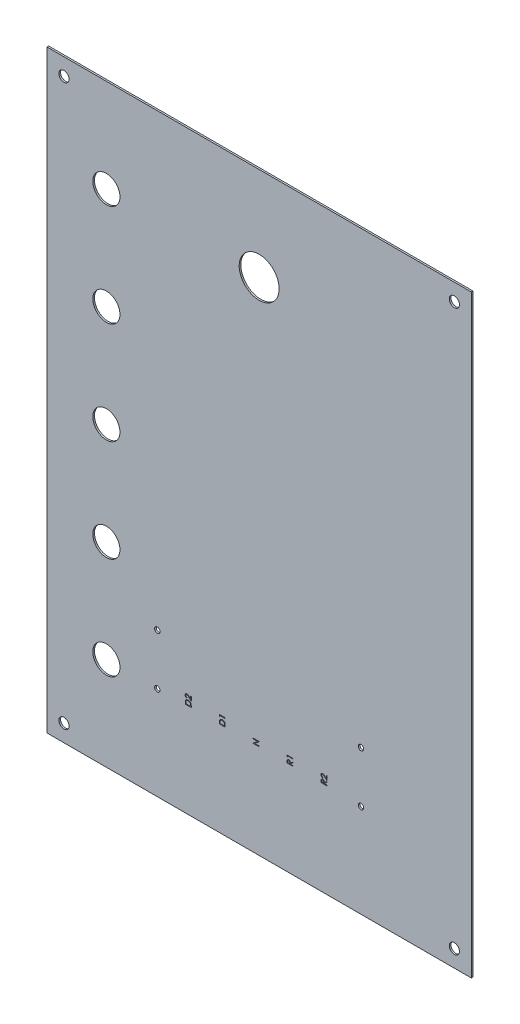
from build123d import *

# Parameters (mm, degrees)
SKETCH1_W           = 350
SKETCH1_H           = 250
BOSS_EXTRUDE1_DEPTH = 1
SKETCH3_R           = 8
SKETCH3_R_2         = 11.75
SKETCH3_R_3         = 3
CUT_EXTRUDE2_DEPTH  = 216.060456616
SKETCH4_R           = 1.6
CUT_EXTRUDE5_DEPTH  = 216.060456616


with BuildPart() as part:
    # Sketch1 → Boss-Extrude1 (new body)
    with BuildSketch(Plane(origin=(0, 0, 0), x_dir=(0, 1, 0), z_dir=(0, 0, 1))):
        Rectangle(SKETCH1_W, SKETCH1_H)
    extrude(amount=BOSS_EXTRUDE1_DEPTH)

    # Sketch3 → Cut-Extrude2 (cut, through all)
    with BuildSketch(Plane(origin=(0, 0, 1), x_dir=(0, -1, 0), z_dir=(0, 0, 1))):
        with Locations(Location((120, -90, 0), (0, 0, 90))):
            Circle(SKETCH3_R)
        with Locations(Location((60, -90, 0), (0, 0, 90))):
            Circle(SKETCH3_R)
        with Locations(Location((0, -90, 0), (0, 0, 90))):
            Circle(SKETCH3_R)
        with Locations(Location((-60, -90, 0), (0, 0, 90))):
            Circle(SKETCH3_R)
        with Locations(Location((-120, -90, 0), (0, 0, 90))):
            Circle(SKETCH3_R)
        with Locations(Location((-120, 0, 0), (0, 0, 90))):
            Circle(SKETCH3_R_2)
        with Locations(Location((-165, 115, 0), (0, 0, 90))):
            Circle(SKETCH3_R_3)
        with Locations(Location((165, 115, 0), (0, 0, 270))):
            Circle(SKETCH3_R_3)
        with Locations(Location((-165, -115, 0), (0, 0, 270))):
            Circle(SKETCH3_R_3)
        with Locations(Location((165, -115, 0), (0, 0, 90))):
            Circle(SKETCH3_R_3)
    extrude(amount=-CUT_EXTRUDE2_DEPTH, mode=Mode.SUBTRACT)

    # Sketch4 → Cut-Extrude5 (cut, through all)
    # profile 1 of 13: a face of its own
    with BuildSketch(Plane.XY.offset(1)):
        with Locations((-60, -90)):
            Circle(SKETCH4_R)
    # profile 2 of 13: a face of its own
    with BuildSketch(Plane.XY.offset(1)):
        with Locations((-60, -120)):
            Circle(SKETCH4_R)
    # profile 3 of 13: a face of its own
    with BuildSketch(Plane.XY.offset(1)):
        with Locations((60, -120)):
            Circle(SKETCH4_R)
    # profile 4 of 13: a face of its own
    with BuildSketch(Plane.XY.offset(1)):
        with Locations((60, -90)):
            Circle(SKETCH4_R)
    # profile 5 of 13: a face of its own
    with BuildSketch(Plane.XY.offset(1)):
        Polygon((0, -119.551282051), (-3.5, -119.551282051), (-3.5, -119.385116186), (-0.840645032, -117.262820513), (-3.5, -117.262820513), (-3.5, -116.814102564), (0, -116.814102564), (0, -116.997796474), (-2.65234375, -119.102564103), (0, -119.102564103), align=None)
    # profile 6 of 13: a face of its own
    with BuildSketch(Plane.XY.offset(1)):
        with BuildLine():
            Line((-20, -119.551282051), (-23.5, -119.551282051))
            Line((-23.5, -119.551282051), (-23.5, -118.810196314))
            add(Edge.make_bspline(
                [(-23.5, -118.810196314), (-23.499565027, -118.747792139), (-23.498727477, -118.627631633), (-23.493234853, -118.453921639), (-23.483790187, -118.293721756), (-23.469554099, -118.146688708), (-23.452811206, -118.012970213), (-23.430660657, -117.89260876), (-23.406782473, -117.785144332), (-23.384823452, -117.719340003), (-23.374499199, -117.688401442)],
                knots=[0, 0, 0, 0, 1.321377177, 2.544338591, 3.679698859, 4.71869479, 5.671952218, 6.531967125, 7.309789724, 8, 8, 8, 8], degree=3))
            add(Edge.make_bspline(
                [(-23.374499199, -117.688401442), (-23.358176671, -117.645084061), (-23.32596025, -117.559586828), (-23.265485874, -117.438448809), (-23.19913903, -117.324002565), (-23.123827429, -117.217674059), (-23.040025499, -117.119666337), (-22.94956359, -117.028297428), (-22.849804226, -116.946386531), (-22.743562846, -116.871355716), (-22.630716586, -116.804875293), (-22.512747692, -116.747330725), (-22.389882686, -116.698729448), (-22.26243433, -116.658758902), (-22.130173198, -116.62812598), (-21.993459117, -116.605489874), (-21.851938329, -116.591964268), (-21.755871929, -116.590490027), (-21.707231571, -116.58974359)],
                knots=[0, 0, 0, 0, 1.037989101, 2.048720264, 3.03347809, 4.003905725, 4.967380877, 5.923996735, 6.884742632, 7.859453364, 8.839691521, 9.819957728, 10.801471334, 11.80152298, 12.813966534, 13.844978706, 14.908869198, 16, 16, 16, 16], degree=3))
            add(Edge.make_bspline(
                [(-21.707231571, -116.58974359), (-21.665141328, -116.590395755), (-21.581995805, -116.591684048), (-21.458854, -116.602580174), (-21.339169619, -116.619827988), (-21.223012848, -116.644468967), (-21.110571935, -116.676021295), (-21.001646024, -116.714655017), (-20.896203927, -116.760281018), (-20.794957836, -116.812839983), (-20.698354695, -116.87073506), (-20.607807367, -116.933913062), (-20.523505433, -117.001621313), (-20.44449135, -117.072527835), (-20.373527485, -117.14993001), (-20.308248254, -117.231095278), (-20.249034348, -117.317011691), (-20.196089106, -117.408072919), (-20.148949784, -117.506034944), (-20.109692107, -117.612870337), (-20.07513346, -117.728220386), (-20.047028562, -117.852807448), (-20.02670375, -117.986668222), (-20.011421239, -118.129365363), (-20.001108006, -118.280932485), (-20.000376224, -118.385065016), (-20, -118.438601763)],
                knots=[0, 0, 0, 0, 1.058281763, 2.0905413, 3.106204812, 4.097498761, 5.074314083, 6.040909996, 7.00168164, 7.9611042, 8.907532461, 9.831953762, 10.735113336, 11.625407939, 12.49874225, 13.372531262, 14.243053022, 15.120018348, 16.019038131, 16.973099588, 17.979041482, 19.045516265, 20.181799967, 21.381832148, 22.653944259, 24, 24, 24, 24], degree=3))
            Line((-20, -118.438601763), (-20, -119.551282051))
        make_face()
        with BuildLine():
            Line((-20.403846154, -119.102564103), (-20.403846154, -118.798277244))
            add(Edge.make_bspline(
                [(-20.403846154, -118.798277244), (-20.404062201, -118.742183091), (-20.404477258, -118.634418334), (-20.409078073, -118.479466026), (-20.414571355, -118.337965244), (-20.424770566, -118.210369917), (-20.436153211, -118.096400473), (-20.450861026, -117.996054539), (-20.467400525, -117.908921867), (-20.482932036, -117.856343292), (-20.490084135, -117.83213141)],
                knots=[0, 0, 0, 0, 1.383618687, 2.658126108, 3.823786659, 4.876093986, 5.815132222, 6.648351516, 7.377580062, 8, 8, 8, 8], degree=3))
            add(Edge.make_bspline(
                [(-20.490084135, -117.83213141), (-20.500844025, -117.802035425), (-20.522098268, -117.742586178), (-20.561649056, -117.657402627), (-20.607271102, -117.577120026), (-20.659375365, -117.502007605), (-20.717276764, -117.431430969), (-20.780909755, -117.365333756), (-20.851582991, -117.304892058), (-20.92789054, -117.249729403), (-21.009315905, -117.199754526), (-21.095580283, -117.156286322), (-21.186348349, -117.119723225), (-21.281630866, -117.090305195), (-21.381463029, -117.06723147), (-21.485907975, -117.050402741), (-21.594863777, -117.040588117), (-21.6688839, -117.039178479), (-21.706530449, -117.038461538)],
                knots=[0, 0, 0, 0, 0.982752151, 1.941251509, 2.884642607, 3.81989091, 4.749569158, 5.690107307, 6.638279664, 7.606035175, 8.583752337, 9.573969829, 10.573847701, 11.590232413, 12.638259993, 13.723212808, 14.842028696, 16, 16, 16, 16], degree=3))
            add(Edge.make_bspline(
                [(-21.706530449, -117.038461538), (-21.746059657, -117.039024882), (-21.82388115, -117.040133941), (-21.938309956, -117.052170457), (-22.04857417, -117.068993036), (-22.154347201, -117.094330152), (-22.255300973, -117.127716025), (-22.352578476, -117.166457458), (-22.444680765, -117.213997815), (-22.532204056, -117.267765221), (-22.614236013, -117.327834747), (-22.689524096, -117.394232209), (-22.758869151, -117.465732639), (-22.820179723, -117.544068231), (-22.876377407, -117.627016936), (-22.924304473, -117.716284056), (-22.966382594, -117.810895476), (-22.98826926, -117.877027621), (-22.999399038, -117.910657051)],
                knots=[0, 0, 0, 0, 1.129217777, 2.223100788, 3.284889252, 4.31516385, 5.326848226, 6.321524555, 7.304244934, 8.284784113, 9.254596696, 10.205833222, 11.15055266, 12.096616828, 13.045035565, 14.010353181, 14.988227444, 16, 16, 16, 16], degree=3))
            add(Edge.make_bspline(
                [(-22.999399038, -117.910657051), (-23.007223469, -117.939086005), (-23.023844137, -117.999474836), (-23.042949884, -118.097913266), (-23.059729845, -118.208768615), (-23.072337066, -118.332832726), (-23.084197098, -118.469039691), (-23.090161262, -118.618521866), (-23.095717442, -118.780474324), (-23.096005011, -118.892922464), (-23.096153846, -118.951121795)],
                knots=[0, 0, 0, 0, 0.675040731, 1.433922685, 2.294542329, 3.241980539, 4.289142419, 5.42504389, 6.667290348, 8, 8, 8, 8], degree=3))
            Line((-23.096153846, -118.951121795), (-23.096153846, -119.102564103))
            Line((-23.096153846, -119.102564103), (-20.403846154, -119.102564103))
        make_face(mode=Mode.SUBTRACT)
    # profile 7 of 13: a face of its own
    with BuildSketch(Plane.XY.offset(1)):
        Polygon((-23.5, -115.466546474), (-23.5, -114.705128205), (-20, -114.705128205), (-20, -115.153846154), (-23.096153846, -115.153846154), (-23.096153846, -115.692307692), align=None)
    # profile 8 of 13: a face of its own
    with BuildSketch(Plane.XY.offset(1)):
        with BuildLine():
            Line((-40, -119.551282051), (-43.5, -119.551282051))
            Line((-43.5, -119.551282051), (-43.5, -118.810196314))
            add(Edge.make_bspline(
                [(-43.5, -118.810196314), (-43.499565027, -118.747792139), (-43.498727477, -118.627631633), (-43.493234853, -118.453921639), (-43.483790187, -118.293721756), (-43.469554099, -118.146688708), (-43.452811206, -118.012970213), (-43.430660657, -117.89260876), (-43.406782473, -117.785144332), (-43.384823452, -117.719340003), (-43.374499199, -117.688401442)],
                knots=[0, 0, 0, 0, 1.321377177, 2.544338591, 3.679698859, 4.71869479, 5.671952218, 6.531967125, 7.309789724, 8, 8, 8, 8], degree=3))
            add(Edge.make_bspline(
                [(-43.374499199, -117.688401442), (-43.358176671, -117.645084061), (-43.32596025, -117.559586828), (-43.265485874, -117.438448809), (-43.19913903, -117.324002565), (-43.123827429, -117.217674059), (-43.040025499, -117.119666337), (-42.94956359, -117.028297428), (-42.849804226, -116.946386531), (-42.743562846, -116.871355716), (-42.630716586, -116.804875293), (-42.512747692, -116.747330725), (-42.389882686, -116.698729448), (-42.26243433, -116.658758902), (-42.130173198, -116.62812598), (-41.993459117, -116.605489874), (-41.851938329, -116.591964268), (-41.755871929, -116.590490027), (-41.707231571, -116.58974359)],
                knots=[0, 0, 0, 0, 1.037989101, 2.048720264, 3.03347809, 4.003905725, 4.967380877, 5.923996735, 6.884742632, 7.859453364, 8.839691521, 9.819957728, 10.801471334, 11.80152298, 12.813966534, 13.844978706, 14.908869198, 16, 16, 16, 16], degree=3))
            add(Edge.make_bspline(
                [(-41.707231571, -116.58974359), (-41.665141328, -116.590395755), (-41.581995805, -116.591684048), (-41.458854, -116.602580174), (-41.339169619, -116.619827988), (-41.223012848, -116.644468967), (-41.110571935, -116.676021295), (-41.001646024, -116.714655017), (-40.896203927, -116.760281018), (-40.794957836, -116.812839983), (-40.698354695, -116.87073506), (-40.607807367, -116.933913062), (-40.523505433, -117.001621313), (-40.44449135, -117.072527835), (-40.373527485, -117.14993001), (-40.308248254, -117.231095278), (-40.249034348, -117.317011691), (-40.196089106, -117.408072919), (-40.148949784, -117.506034944), (-40.109692107, -117.612870337), (-40.07513346, -117.728220386), (-40.047028562, -117.852807448), (-40.02670375, -117.986668222), (-40.011421239, -118.129365363), (-40.001108006, -118.280932485), (-40.000376224, -118.385065016), (-40, -118.438601763)],
                knots=[0, 0, 0, 0, 1.058281763, 2.0905413, 3.106204812, 4.097498761, 5.074314083, 6.040909996, 7.00168164, 7.9611042, 8.907532461, 9.831953762, 10.735113336, 11.625407939, 12.49874225, 13.372531262, 14.243053022, 15.120018348, 16.019038131, 16.973099588, 17.979041482, 19.045516265, 20.181799967, 21.381832148, 22.653944259, 24, 24, 24, 24], degree=3))
            Line((-40, -118.438601763), (-40, -119.551282051))
        make_face()
        with BuildLine():
            Line((-40.403846154, -119.102564103), (-40.403846154, -118.798277244))
            add(Edge.make_bspline(
                [(-40.403846154, -118.798277244), (-40.404062201, -118.742183091), (-40.404477258, -118.634418334), (-40.409078073, -118.479466026), (-40.414571355, -118.337965244), (-40.424770566, -118.210369917), (-40.436153211, -118.096400473), (-40.450861026, -117.996054539), (-40.467400525, -117.908921867), (-40.482932036, -117.856343292), (-40.490084135, -117.83213141)],
                knots=[0, 0, 0, 0, 1.383618687, 2.658126108, 3.823786659, 4.876093986, 5.815132222, 6.648351516, 7.377580062, 8, 8, 8, 8], degree=3))
            add(Edge.make_bspline(
                [(-40.490084135, -117.83213141), (-40.500844025, -117.802035425), (-40.522098268, -117.742586178), (-40.561649056, -117.657402627), (-40.607271102, -117.577120026), (-40.659375365, -117.502007605), (-40.717276764, -117.431430969), (-40.780909755, -117.365333756), (-40.851582991, -117.304892058), (-40.92789054, -117.249729403), (-41.009315905, -117.199754526), (-41.095580283, -117.156286322), (-41.186348349, -117.119723225), (-41.281630866, -117.090305195), (-41.381463029, -117.06723147), (-41.485907975, -117.050402741), (-41.594863777, -117.040588117), (-41.6688839, -117.039178479), (-41.706530449, -117.038461538)],
                knots=[0, 0, 0, 0, 0.982752151, 1.941251509, 2.884642607, 3.81989091, 4.749569158, 5.690107307, 6.638279664, 7.606035175, 8.583752337, 9.573969829, 10.573847701, 11.590232413, 12.638259993, 13.723212808, 14.842028696, 16, 16, 16, 16], degree=3))
            add(Edge.make_bspline(
                [(-41.706530449, -117.038461538), (-41.746059657, -117.039024882), (-41.82388115, -117.040133941), (-41.938309956, -117.052170457), (-42.04857417, -117.068993036), (-42.154347201, -117.094330152), (-42.255300973, -117.127716025), (-42.352578476, -117.166457458), (-42.444680765, -117.213997815), (-42.532204056, -117.267765221), (-42.614236013, -117.327834747), (-42.689524096, -117.394232209), (-42.758869151, -117.465732639), (-42.820179723, -117.544068231), (-42.876377407, -117.627016936), (-42.924304473, -117.716284056), (-42.966382594, -117.810895476), (-42.98826926, -117.877027621), (-42.999399038, -117.910657051)],
                knots=[0, 0, 0, 0, 1.129217777, 2.223100788, 3.284889252, 4.31516385, 5.326848226, 6.321524555, 7.304244934, 8.284784113, 9.254596696, 10.205833222, 11.15055266, 12.096616828, 13.045035565, 14.010353181, 14.988227444, 16, 16, 16, 16], degree=3))
            add(Edge.make_bspline(
                [(-42.999399038, -117.910657051), (-43.007223469, -117.939086005), (-43.023844137, -117.999474836), (-43.042949884, -118.097913266), (-43.059729845, -118.208768615), (-43.072337066, -118.332832726), (-43.084197098, -118.469039691), (-43.090161262, -118.618521866), (-43.095717442, -118.780474324), (-43.096005011, -118.892922464), (-43.096153846, -118.951121795)],
                knots=[0, 0, 0, 0, 0.675040731, 1.433922685, 2.294542329, 3.241980539, 4.289142419, 5.42504389, 6.667290348, 8, 8, 8, 8], degree=3))
            Line((-43.096153846, -118.951121795), (-43.096153846, -119.102564103))
            Line((-43.096153846, -119.102564103), (-40.403846154, -119.102564103))
        make_face(mode=Mode.SUBTRACT)
    # profile 9 of 13: a face of its own
    with BuildSketch(Plane.XY.offset(1)):
        with BuildLine():
            Line((-42.378205128, -115.65234375), (-42.378205128, -116.096153846))
            add(Edge.make_bspline(
                [(-42.378205128, -116.096153846), (-42.423365192, -116.094069137), (-42.511692081, -116.089991731), (-42.640394226, -116.071885946), (-42.761664477, -116.042555865), (-42.876530883, -116.00553511), (-42.983557551, -115.956150456), (-43.084610232, -115.899170443), (-43.177571059, -115.830382476), (-43.262587089, -115.752648315), (-43.339827461, -115.668265139), (-43.406430367, -115.577552828), (-43.463185877, -115.482044702), (-43.509498749, -115.381721979), (-43.545357921, -115.276388187), (-43.571451742, -115.166343569), (-43.587146556, -115.051237068), (-43.58886991, -114.972771883), (-43.58974359, -114.932992788)],
                knots=[0, 0, 0, 0, 1.154964179, 2.258951466, 3.315045469, 4.34063582, 5.337653555, 6.322213479, 7.300594401, 8.285733883, 9.262436119, 10.219305053, 11.156568068, 12.097250375, 13.037875795, 13.995471444, 14.983774372, 16, 16, 16, 16], degree=3))
            add(Edge.make_bspline(
                [(-43.58974359, -114.932992788), (-43.588899182, -114.891341274), (-43.587242222, -114.809609486), (-43.57140455, -114.69063427), (-43.546399455, -114.577790424), (-43.510398399, -114.472012875), (-43.465447251, -114.371724657), (-43.409367221, -114.278551822), (-43.342422415, -114.192331155), (-43.267345559, -114.112830152), (-43.184801245, -114.042279564), (-43.099380687, -113.979279937), (-43.010447426, -113.92656784), (-42.919115228, -113.882659392), (-42.824652967, -113.848829415), (-42.727397816, -113.824949138), (-42.627296193, -113.810632446), (-42.55960807, -113.808678575), (-42.525440705, -113.807692308)],
                knots=[0, 0, 0, 0, 1.156390122, 2.269157192, 3.327440109, 4.362064621, 5.367250153, 6.374780632, 7.374564557, 8.393966234, 9.406482505, 10.386793437, 11.338664528, 12.273628894, 13.197621568, 14.120245026, 15.051144114, 16, 16, 16, 16], degree=3))
            add(Edge.make_bspline(
                [(-42.525440705, -113.807692308), (-42.477646268, -113.809487169), (-42.382712138, -113.813052303), (-42.242261728, -113.840503193), (-42.106338325, -113.886656104), (-41.995650466, -113.939952632), (-41.906205745, -113.993890547), (-41.832291433, -114.043278222), (-41.752719962, -114.101815932), (-41.666057702, -114.168141566), (-41.574980884, -114.24514764), (-41.476325224, -114.329181955), (-41.371967065, -114.422350784), (-41.301371752, -114.488559499), (-41.264823718, -114.522836538)],
                knots=[0, 0, 0, 0, 1.156089225, 2.296340959, 3.448119842, 4.621837246, 5.261023765, 5.974732268, 6.772256611, 7.651229907, 8.615046527, 9.657893557, 10.787463607, 12, 12, 12, 12], degree=3))
            Line((-41.264823718, -114.522836538), (-40.403846154, -115.383814103))
            Line((-40.403846154, -115.383814103), (-40.403846154, -113.762820513))
            Line((-40.403846154, -113.762820513), (-40, -113.762820513))
            Line((-40, -113.762820513), (-40, -116.230769231))
            Line((-40, -116.230769231), (-41.478665865, -114.891626603))
            add(Edge.make_bspline(
                [(-41.478665865, -114.891626603), (-41.512683234, -114.85973), (-41.577963187, -114.798519838), (-41.673522556, -114.712252779), (-41.761865701, -114.63442058), (-41.842928848, -114.564608286), (-41.917801571, -114.504643998), (-41.985382362, -114.452914555), (-42.045990351, -114.410005545), (-42.117331, -114.365444334), (-42.202849037, -114.321288745), (-42.307169035, -114.283726383), (-42.413702382, -114.261187127), (-42.485372571, -114.258003326), (-42.521233974, -114.256410256)],
                knots=[0, 0, 0, 0, 1.341560447, 2.574479018, 3.703506985, 4.728875774, 5.651874962, 6.462761537, 7.177175968, 7.787249671, 8.88179658, 9.938774664, 10.968630673, 12, 12, 12, 12], degree=3))
            add(Edge.make_bspline(
                [(-42.521233974, -114.256410256), (-42.543480909, -114.256803055), (-42.587500974, -114.257580286), (-42.651965212, -114.268168297), (-42.71448366, -114.283098113), (-42.774090414, -114.306133196), (-42.83198896, -114.334169741), (-42.887788934, -114.368505081), (-42.94013955, -114.410516219), (-42.990486935, -114.456985172), (-43.036223638, -114.508050542), (-43.075886206, -114.563071454), (-43.110453525, -114.619952389), (-43.137821516, -114.680597952), (-43.160088301, -114.743547486), (-43.17385447, -114.809883237), (-43.184862743, -114.878411324), (-43.185547889, -114.925231778), (-43.185897436, -114.94911859)],
                knots=[0, 0, 0, 0, 0.99914257, 1.977005933, 2.930167165, 3.88454398, 4.843249581, 5.820096159, 6.82282395, 7.856298586, 8.898232475, 9.898700315, 10.902473675, 11.885180484, 12.885427567, 13.897526593, 14.927362223, 16, 16, 16, 16], degree=3))
            add(Edge.make_bspline(
                [(-43.185897436, -114.94911859), (-43.185431821, -114.971820219), (-43.184515835, -115.016480284), (-43.175064975, -115.082253284), (-43.159677117, -115.145387221), (-43.138332755, -115.206095072), (-43.11199999, -115.264816536), (-43.077885945, -115.320115772), (-43.038200799, -115.372896631), (-42.993660196, -115.423856888), (-42.941405201, -115.470236599), (-42.882055048, -115.511719806), (-42.815545067, -115.548351115), (-42.741991609, -115.579661885), (-42.661201706, -115.605610651), (-42.573273595, -115.626426658), (-42.47816901, -115.642519443), (-42.412142839, -115.6490084), (-42.378205128, -115.65234375)],
                knots=[0, 0, 0, 0, 0.911540883, 1.79324023, 2.663162255, 3.518366492, 4.375475705, 5.243419306, 6.122264358, 7.02676621, 7.957780629, 8.921596253, 9.930241338, 11.002848587, 12.128200329, 13.335197372, 14.630280975, 16, 16, 16, 16], degree=3))
        make_face()
    # profile 10 of 13: a face of its own
    with BuildSketch(Plane.XY.offset(1)):
        with BuildLine():
            Line((16.5, -119.551282051), (16.5, -118.850861378))
            add(Edge.make_bspline(
                [(16.5, -118.850861378), (16.500155586, -118.80412025), (16.500454328, -118.714372105), (16.502120091, -118.585798835), (16.506894447, -118.468971738), (16.51100303, -118.363951899), (16.518494972, -118.270741244), (16.525655619, -118.189053953), (16.53502928, -118.119266255), (16.543734703, -118.077020404), (16.547676282, -118.057892628)],
                knots=[0, 0, 0, 0, 1.410062039, 2.707475311, 3.878576406, 4.937260626, 5.877586885, 6.699081471, 7.410979367, 8, 8, 8, 8], degree=3))
            add(Edge.make_bspline(
                [(16.547676282, -118.057892628), (16.554003064, -118.032286024), (16.566521662, -117.981619074), (16.592981015, -117.908668719), (16.623601552, -117.839155461), (16.659561947, -117.773361751), (16.701149074, -117.711640388), (16.747570963, -117.65326805), (16.798733851, -117.598434216), (16.855098955, -117.54785451), (16.915465334, -117.501910379), (16.979667312, -117.461610298), (17.047439425, -117.427557472), (17.118887235, -117.400834743), (17.193221492, -117.378411438), (17.271200889, -117.363345739), (17.352565107, -117.35396128), (17.407926436, -117.353034188), (17.435997596, -117.352564103)],
                knots=[0, 0, 0, 0, 1.02737844, 2.032840108, 3.019645024, 3.985760442, 4.950801802, 5.916702504, 6.889791722, 7.870143693, 8.864820395, 9.842884691, 10.820524757, 11.815201459, 12.812418953, 13.84314332, 14.906358105, 16, 16, 16, 16], degree=3))
            add(Edge.make_bspline(
                [(17.435997596, -117.352564103), (17.482632701, -117.354033101), (17.573629869, -117.356899496), (17.70569075, -117.3836246), (17.828880065, -117.42740112), (17.943042703, -117.487724409), (18.045953348, -117.564543885), (18.136343803, -117.656868676), (18.211983716, -117.764750287), (18.264436521, -117.865179603), (18.298029429, -117.953893803), (18.321665788, -118.026927116), (18.339927753, -118.106594093), (18.356287885, -118.192131428), (18.36863958, -118.283895083), (18.377686174, -118.381665123), (18.383340223, -118.485511274), (18.384182228, -118.556850344), (18.384615385, -118.593549679)],
                knots=[0, 0, 0, 0, 1.260483769, 2.459530307, 3.627416485, 4.787058657, 5.939039949, 7.08810263, 8.267026773, 9.491475466, 10.141966685, 10.831826277, 11.566392101, 12.351337768, 13.187381173, 14.07005841, 15.007169909, 16, 16, 16, 16], degree=3))
            Line((18.384615385, -118.593549679), (20, -117.307692308))
            Line((20, -117.307692308), (20, -117.696113782))
            Line((20, -117.696113782), (18.384615385, -118.981971154))
            Line((18.384615385, -118.981971154), (18.384615385, -119.237179487))
            Line((18.384615385, -119.237179487), (20, -119.237179487))
            Line((20, -119.237179487), (20, -119.551282051))
            Line((20, -119.551282051), (16.5, -119.551282051))
        make_face()
        with BuildLine():
            Line((16.858974359, -119.237179487), (18.025641026, -119.237179487))
            Line((18.025641026, -119.237179487), (18.030548878, -118.596354167))
            add(Edge.make_bspline(
                [(18.030548878, -118.596354167), (18.030562123, -118.566434124), (18.030587794, -118.508440559), (18.026593914, -118.424539947), (18.02205095, -118.346419656), (18.015100421, -118.274379503), (18.006148236, -118.208383959), (17.994932575, -118.148476966), (17.981921822, -118.094524993), (17.961575546, -118.031805171), (17.930748318, -117.960940791), (17.882868093, -117.885610437), (17.825336481, -117.819514095), (17.757650075, -117.765683534), (17.68441132, -117.720582293), (17.604870116, -117.690230952), (17.521606702, -117.670003072), (17.464398252, -117.667791624), (17.435296474, -117.666666667)],
                knots=[0, 0, 0, 0, 1.146477201, 2.22219935, 3.21835465, 4.145220026, 4.995151787, 5.769831222, 6.480173269, 7.120302478, 8.295254187, 9.430763426, 10.528629691, 11.636497428, 12.733230534, 13.811001502, 14.886462612, 16, 16, 16, 16], degree=3))
            add(Edge.make_bspline(
                [(17.435296474, -117.666666667), (17.407152196, -117.667872257), (17.351380505, -117.670261298), (17.269690948, -117.6896592), (17.192568424, -117.722821854), (17.119913357, -117.766447473), (17.054992053, -117.82119781), (16.998841303, -117.884162341), (16.952874184, -117.95532895), (16.922322772, -118.021257962), (16.904381275, -118.080658684), (16.891340833, -118.131987719), (16.88229028, -118.190269796), (16.873717756, -118.255239867), (16.866778066, -118.327021922), (16.861991163, -118.405826349), (16.859187737, -118.491164979), (16.85904714, -118.550311643), (16.858974359, -118.580929487)],
                knots=[0, 0, 0, 0, 1.100823979, 2.181431445, 3.263702604, 4.376021382, 5.48638238, 6.575013887, 7.666064109, 8.791843368, 9.405226397, 10.093019944, 10.863016055, 11.711746407, 12.658404307, 13.684961631, 14.801597923, 16, 16, 16, 16], degree=3))
            Line((16.858974359, -118.580929487), (16.858974359, -119.237179487))
        make_face(mode=Mode.SUBTRACT)
    # profile 11 of 13: a face of its own
    with BuildSketch(Plane.XY.offset(1)):
        Polygon((16.5, -116.159955929), (16.5, -115.512820513), (20, -115.512820513), (20, -115.826923077), (16.858974359, -115.826923077), (16.858974359, -116.365384615), align=None)
    # profile 12 of 13: a face of its own
    with BuildSketch(Plane.XY.offset(1)):
        with BuildLine():
            Line((36.5, -119.551282051), (36.5, -118.834735577))
            add(Edge.make_bspline(
                [(36.5, -118.834735577), (36.500111325, -118.788693777), (36.500324382, -118.700578027), (36.502560119, -118.574138909), (36.505521156, -118.459335553), (36.511706332, -118.356081194), (36.517165896, -118.264099329), (36.52614535, -118.183787794), (36.534154051, -118.114768476), (36.54296523, -118.073271925), (36.54697516, -118.054387019)],
                knots=[0, 0, 0, 0, 1.411347063, 2.701065231, 3.876524531, 4.931206492, 5.871916627, 6.700262025, 7.408494688, 8, 8, 8, 8], degree=3))
            add(Edge.make_bspline(
                [(36.54697516, -118.054387019), (36.554053936, -118.026228185), (36.568000201, -117.970750993), (36.595457442, -117.890825082), (36.62782756, -117.815367867), (36.664932516, -117.744478802), (36.706958685, -117.677987441), (36.755173898, -117.61718017), (36.807115276, -117.559661546), (36.864412424, -117.507650916), (36.925341176, -117.46032911), (36.989890794, -117.419867726), (37.057194374, -117.385151503), (37.127151868, -117.356176906), (37.200543404, -117.334512121), (37.276828832, -117.319337195), (37.355781587, -117.30889368), (37.409554452, -117.308095317), (37.436698718, -117.307692308)],
                knots=[0, 0, 0, 0, 1.103820101, 2.174693741, 3.209859002, 4.223626675, 5.214778413, 6.196198804, 7.171320727, 8.158999421, 9.134971582, 10.10159085, 11.051641808, 12.012235658, 12.97676874, 13.956376421, 14.968389326, 16, 16, 16, 16], degree=3))
            add(Edge.make_bspline(
                [(37.436698718, -117.307692308), (37.481460139, -117.309219046), (37.569660631, -117.312227418), (37.698058598, -117.338704597), (37.81893933, -117.382956304), (37.91322044, -117.433254692), (37.984046589, -117.481465072), (38.034058838, -117.522249648), (38.080214705, -117.567511058), (38.12427598, -117.616068032), (38.164528899, -117.66927469), (38.202039764, -117.726289288), (38.235549404, -117.787692813), (38.277140427, -117.875400283), (38.320079279, -117.994471157), (38.357073755, -118.148183778), (38.379498564, -118.314320944), (38.382875138, -118.429182914), (38.384615385, -118.48838141)],
                knots=[0, 0, 0, 0, 1.258852385, 2.480515536, 3.67080299, 4.871459928, 5.477196669, 6.080248789, 6.684984666, 7.295169526, 7.924036935, 8.560767629, 9.214365395, 9.891120314, 11.291591118, 12.767339781, 14.333925277, 16, 16, 16, 16], degree=3))
            Line((38.384615385, -118.48838141), (40, -117.262820513))
            Line((40, -117.262820513), (40, -117.757111378))
            Line((40, -117.757111378), (38.384615385, -118.982672276))
            Line((38.384615385, -118.982672276), (38.384615385, -119.102564103))
            Line((38.384615385, -119.102564103), (40, -119.102564103))
            Line((40, -119.102564103), (40, -119.551282051))
            Line((40, -119.551282051), (36.5, -119.551282051))
        make_face()
        with BuildLine():
            Line((36.903846154, -119.102564103), (37.981470353, -119.102564103))
            Line((37.981470353, -119.102564103), (37.984975962, -118.587940705))
            add(Edge.make_bspline(
                [(37.984975962, -118.587940705), (37.984905451, -118.560360519), (37.984769169, -118.507053921), (37.981922994, -118.429895896), (37.977208164, -118.358321538), (37.970060923, -118.292650653), (37.962031244, -118.232908917), (37.951435753, -118.179076366), (37.939039632, -118.131063591), (37.920571742, -118.07527585), (37.892156835, -118.012770894), (37.847175421, -117.947035751), (37.794292295, -117.889193943), (37.73221868, -117.841798224), (37.664144635, -117.803866697), (37.59145484, -117.776274838), (37.514567664, -117.75965314), (37.46202097, -117.757503521), (37.435296474, -117.756410256)],
                knots=[0, 0, 0, 0, 1.165994507, 2.253617888, 3.263845833, 4.197896603, 5.046106198, 5.811545427, 6.516148254, 7.141074692, 8.294948521, 9.404874877, 10.495635596, 11.594511476, 12.691475455, 13.779727027, 14.870800984, 16, 16, 16, 16], degree=3))
            add(Edge.make_bspline(
                [(37.435296474, -117.756410256), (37.409516927, -117.757555255), (37.358384164, -117.759826315), (37.283340314, -117.775979074), (37.212543731, -117.80485164), (37.146085421, -117.843158963), (37.086340034, -117.890623589), (37.03369404, -117.945208992), (36.991964763, -118.008266454), (36.963800306, -118.066320393), (36.946136615, -118.118349467), (36.935228263, -118.164419034), (36.925596468, -118.216856728), (36.917130932, -118.275769692), (36.910945924, -118.341049045), (36.907054749, -118.412857624), (36.903997394, -118.491159992), (36.903897839, -118.545636235), (36.903846154, -118.573918269)],
                knots=[0, 0, 0, 0, 1.114111647, 2.20979856, 3.297775031, 4.406653707, 5.514151176, 6.585969385, 7.670234779, 8.768154562, 9.365517569, 10.041721951, 10.812428959, 11.669578816, 12.61341719, 13.645562296, 14.777663698, 16, 16, 16, 16], degree=3))
            Line((36.903846154, -118.573918269), (36.903846154, -119.102564103))
        make_face(mode=Mode.SUBTRACT)
    # profile 13 of 13: a face of its own
    with BuildSketch(Plane.XY.offset(1)):
        with BuildLine():
            Line((37.621794872, -116.280548878), (37.621794872, -116.724358974))
            add(Edge.make_bspline(
                [(37.621794872, -116.724358974), (37.576634808, -116.722274265), (37.488307919, -116.718196859), (37.359605774, -116.700091074), (37.238335523, -116.670760993), (37.123469117, -116.633740239), (37.016442449, -116.584355584), (36.915389768, -116.527375572), (36.822428941, -116.458587605), (36.737412911, -116.380853444), (36.660172539, -116.296470267), (36.593569633, -116.205757957), (36.536814123, -116.11024983), (36.490501251, -116.009927107), (36.454642079, -115.904593315), (36.428548258, -115.794548697), (36.412853444, -115.679442196), (36.41113009, -115.600977012), (36.41025641, -115.561197917)],
                knots=[0, 0, 0, 0, 1.154964179, 2.258951466, 3.315045469, 4.34063582, 5.337653555, 6.322213479, 7.300594401, 8.285733883, 9.262436119, 10.219305053, 11.156568068, 12.097250375, 13.037875795, 13.995471444, 14.983774372, 16, 16, 16, 16], degree=3))
            add(Edge.make_bspline(
                [(36.41025641, -115.561197917), (36.411100818, -115.519546403), (36.412757778, -115.437814614), (36.42859545, -115.318839399), (36.453600545, -115.205995553), (36.489601601, -115.100218003), (36.534552749, -114.999929785), (36.590632779, -114.90675695), (36.657577585, -114.820536283), (36.732654441, -114.741035281), (36.815198755, -114.670484692), (36.900619313, -114.607485066), (36.989552574, -114.554772968), (37.080884772, -114.51086452), (37.175347033, -114.477034544), (37.272602184, -114.453154267), (37.372703807, -114.438837574), (37.44039193, -114.436883704), (37.474559295, -114.435897436)],
                knots=[0, 0, 0, 0, 1.156390122, 2.269157192, 3.327440109, 4.362064621, 5.367250153, 6.374780632, 7.374564557, 8.393966234, 9.406482505, 10.386793437, 11.338664528, 12.273628894, 13.197621568, 14.120245026, 15.051144114, 16, 16, 16, 16], degree=3))
            add(Edge.make_bspline(
                [(37.474559295, -114.435897436), (37.522353732, -114.437692297), (37.617287862, -114.441257431), (37.757738272, -114.468708321), (37.893661675, -114.514861232), (38.004349534, -114.56815776), (38.093794255, -114.622095675), (38.167708567, -114.671483351), (38.247280038, -114.73002106), (38.333942298, -114.796346694), (38.425019116, -114.873352768), (38.523674776, -114.957387084), (38.628032935, -115.050555913), (38.698628248, -115.116764627), (38.735176282, -115.151041667)],
                knots=[0, 0, 0, 0, 1.156089225, 2.296340959, 3.448119842, 4.621837246, 5.261023765, 5.974732268, 6.772256611, 7.651229907, 8.615046527, 9.657893557, 10.787463607, 12, 12, 12, 12], degree=3))
            Line((38.735176282, -115.151041667), (39.596153846, -116.012019231))
            Line((39.596153846, -116.012019231), (39.596153846, -114.391025641))
            Line((39.596153846, -114.391025641), (40, -114.391025641))
            Line((40, -114.391025641), (40, -116.858974359))
            Line((40, -116.858974359), (38.521334135, -115.519831731))
            add(Edge.make_bspline(
                [(38.521334135, -115.519831731), (38.487316766, -115.487935129), (38.422036813, -115.426724966), (38.326477444, -115.340457908), (38.238134299, -115.262625708), (38.157071152, -115.192813415), (38.082198429, -115.132849126), (38.014617638, -115.081119683), (37.954009649, -115.038210673), (37.882669, -114.993649462), (37.797150963, -114.949493873), (37.692830965, -114.911931512), (37.586297618, -114.889392255), (37.514627429, -114.886208454), (37.478766026, -114.884615385)],
                knots=[0, 0, 0, 0, 1.341560447, 2.574479018, 3.703506985, 4.728875774, 5.651874962, 6.462761537, 7.177175968, 7.787249671, 8.88179658, 9.938774664, 10.968630673, 12, 12, 12, 12], degree=3))
            add(Edge.make_bspline(
                [(37.478766026, -114.884615385), (37.456519091, -114.885008183), (37.412499026, -114.885785414), (37.348034788, -114.896373425), (37.28551634, -114.911303241), (37.225909586, -114.934338324), (37.16801104, -114.96237487), (37.112211066, -114.996710209), (37.05986045, -115.038721348), (37.009513065, -115.085190301), (36.963776362, -115.13625567), (36.924113794, -115.191276582), (36.889546475, -115.248157517), (36.862178484, -115.30880308), (36.839911699, -115.371752614), (36.82614553, -115.438088365), (36.815137257, -115.506616452), (36.814452111, -115.553436906), (36.814102564, -115.577323718)],
                knots=[0, 0, 0, 0, 0.99914257, 1.977005933, 2.930167165, 3.88454398, 4.843249581, 5.820096159, 6.82282395, 7.856298586, 8.898232475, 9.898700315, 10.902473675, 11.885180484, 12.885427567, 13.897526593, 14.927362223, 16, 16, 16, 16], degree=3))
            add(Edge.make_bspline(
                [(36.814102564, -115.577323718), (36.814568179, -115.600025347), (36.815484165, -115.644685412), (36.824935025, -115.710458412), (36.840322883, -115.773592349), (36.861667245, -115.834300201), (36.88800001, -115.893021664), (36.922114055, -115.948320901), (36.961799201, -116.00110176), (37.006339804, -116.052062017), (37.058594799, -116.098441728), (37.117944952, -116.139924934), (37.184454933, -116.176556243), (37.258008391, -116.207867014), (37.338798294, -116.233815779), (37.426726405, -116.254631786), (37.52183099, -116.270724571), (37.587857161, -116.277213529), (37.621794872, -116.280548878)],
                knots=[0, 0, 0, 0, 0.911540883, 1.79324023, 2.663162255, 3.518366492, 4.375475705, 5.243419306, 6.122264358, 7.02676621, 7.957780629, 8.921596253, 9.930241338, 11.002848587, 12.128200329, 13.335197372, 14.630280975, 16, 16, 16, 16], degree=3))
        make_face()
    extrude(amount=-CUT_EXTRUDE5_DEPTH, mode=Mode.SUBTRACT)


with BuildPart() as cut_extrude5_piece_1:
    # of the separate pieces the step leaves, piece 1, a body of its own (cut_extrude5_pieces)
    add(part.part.solids().sort_by_distance((125, -175, 0))[0])


with BuildPart() as cut_extrude5_piece_2:
    # of the separate pieces the step leaves, piece 2, a body of its own (cut_extrude5_pieces)
    add(part.part.solids().sort_by_distance((-23.096153846, -119.102564103, 0))[0])


with BuildPart() as cut_extrude5_piece_3:
    # of the separate pieces the step leaves, piece 3, a body of its own (cut_extrude5_pieces)
    add(part.part.solids().sort_by_distance((-43.096153846, -119.102564103, 0))[0])


with BuildPart() as cut_extrude5_piece_4:
    # of the separate pieces the step leaves, piece 4, a body of its own (cut_extrude5_pieces)
    add(part.part.solids().sort_by_distance((16.858974359, -118.580929487, 0))[0])


with BuildPart() as cut_extrude5_piece_5:
    # of the separate pieces the step leaves, piece 5, a body of its own (cut_extrude5_pieces)
    add(part.part.solids().sort_by_distance((36.903846154, -118.573918269, 0))[0])


solid = Compound([cut_extrude5_piece_1.part, cut_extrude5_piece_2.part, cut_extrude5_piece_3.part, cut_extrude5_piece_4.part, cut_extrude5_piece_5.part])
